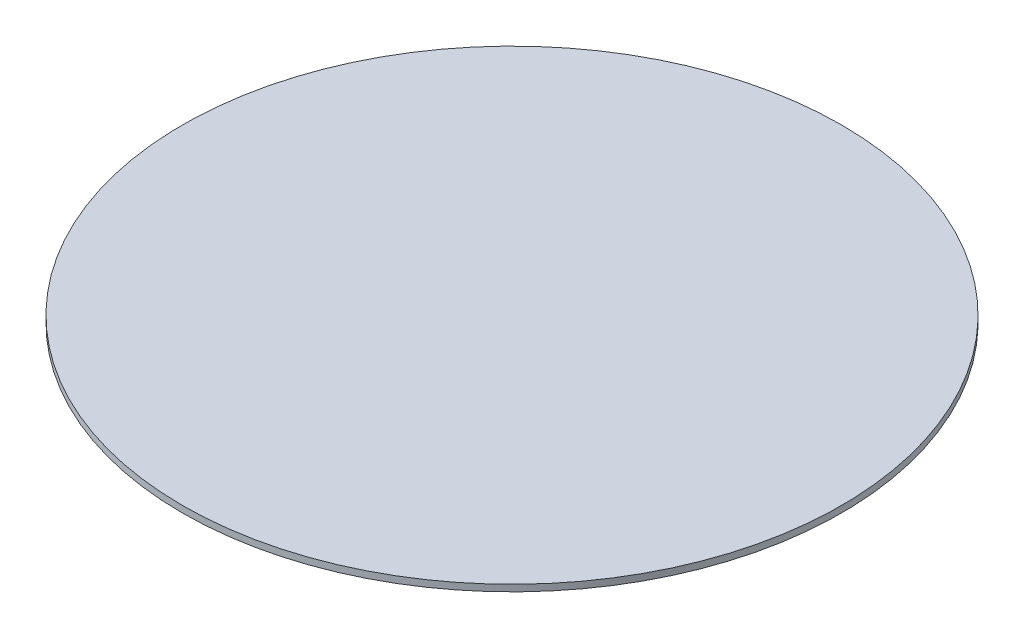
from build123d import *

# Parameters (mm, degrees)
SKETCH1_R           = 500
BOSS_EXTRUDE1_DEPTH = 10


with BuildPart() as part:
    # Sketch1 → Boss-Extrude1 (new body)
    with BuildSketch(Plane(origin=(0, 0, 0), x_dir=(1, 0, 0), z_dir=(0, 1, 0))):
        Circle(SKETCH1_R)
    extrude(amount=BOSS_EXTRUDE1_DEPTH)


solid = part.part
